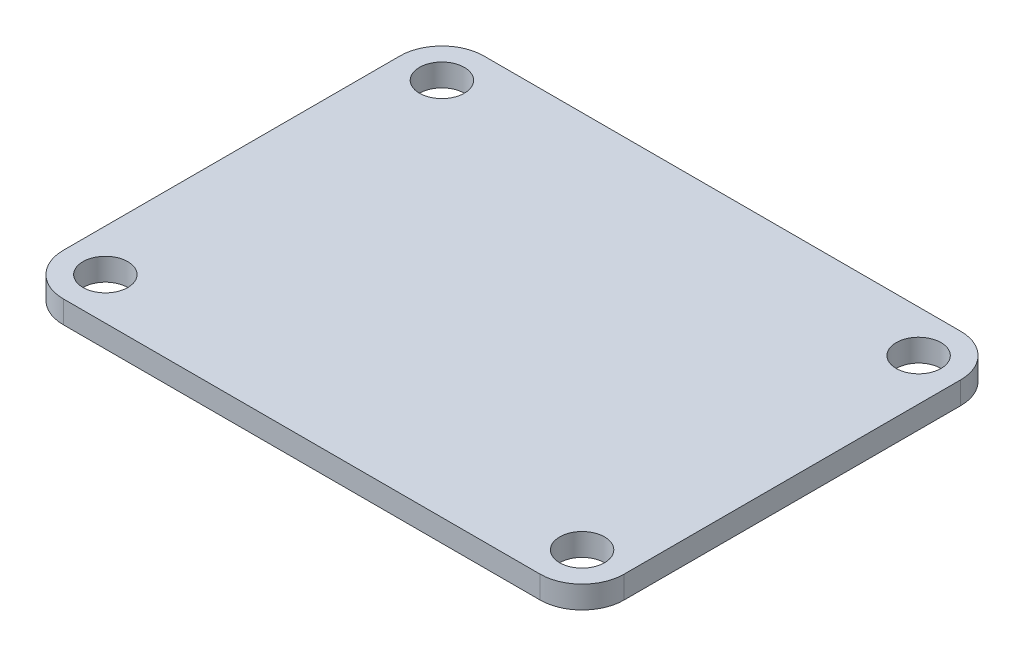
from build123d import *

# Parameters (mm, degrees)
SKETCH_1_R      = 1.6
EXTRUDE_1_DEPTH = 1.6


with BuildPart() as part:
    # Эскиз1 → Бобышка-Вытянуть1 (new body)
    with BuildSketch(Plane(origin=(0, 0, 0), x_dir=(1, 0, 0), z_dir=(0, 1, 0))):
        with BuildLine():
            Line((-17, 15), (17, 15))
            ThreePointArc((17, 15), (19.121320344, 14.121320344), (20, 12))
            Line((20, 12), (20, -12))
            ThreePointArc((20, -12), (19.121320344, -14.121320344), (17, -15))
            Line((17, -15), (-17, -15))
            ThreePointArc((-17, -15), (-19.121320344, -14.121320344), (-20, -12))
            Line((-20, -12), (-20, 12))
            ThreePointArc((-20, 12), (-19.121320344, 14.121320344), (-17, 15))
        make_face()
        with Locations(Location((-17, 12, 0), (0, 0, 270))):
            Circle(SKETCH_1_R, mode=Mode.SUBTRACT)
        with Locations(Location((17, 12, 0), (0, 0, 270))):
            Circle(SKETCH_1_R, mode=Mode.SUBTRACT)
        with Locations(Location((17, -12, 0), (0, 0, 270))):
            Circle(SKETCH_1_R, mode=Mode.SUBTRACT)
        with Locations(Location((-17, -12, 0), (0, 0, 270))):
            Circle(SKETCH_1_R, mode=Mode.SUBTRACT)
    extrude(amount=EXTRUDE_1_DEPTH)


solid = part.part
